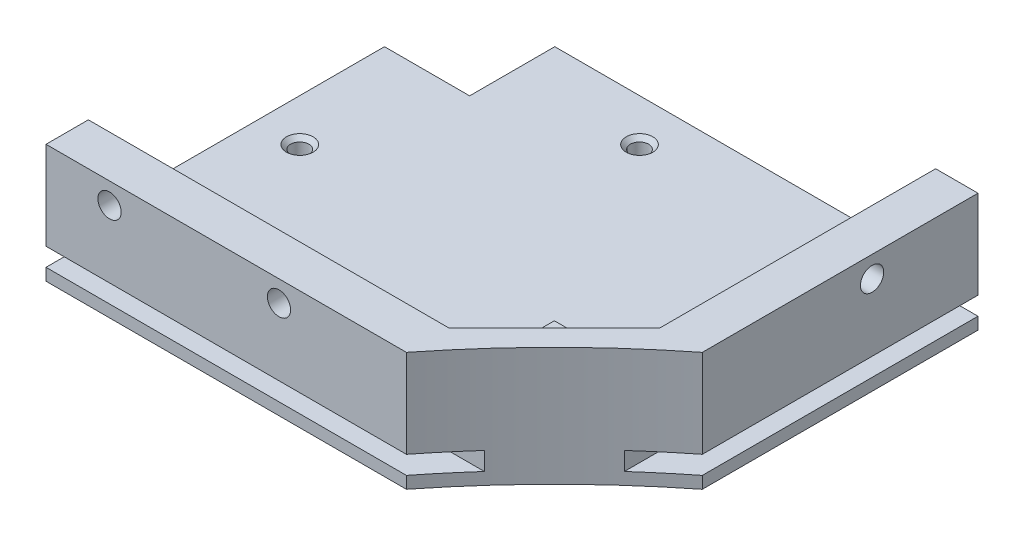
from build123d import *

# Parameters (mm, degrees)
SKETCH1_W                = 650
SKETCH1_H                = 650
BOSS_EXTRUDE1_DEPTH      = 8
BOSS_EXTRUDE2_DEPTH      = 650
CUT_EXTRUDE2_DEPTH       = 921.277302922
CUT_EXTRUDE2_DEPTH_BACK  = 921.277302922
SKETCH4_R                = 11
CUT_EXTRUDE1_DEPTH       = 920.932062709
CUT_EXTRUDE1_DEPTH_BACK  = 920.932062709
SKETCH2_R                = 210
CUT_EXTRUDE3_DEPTH       = 921.277302998
CUT_EXTRUDE3_DEPTH_BACK  = 110
CUT_EXTRUDE4_DEPTH       = 110
CUT_EXTRUDE5_DEPTH       = 920.932062713
CUT_EXTRUDE5_DEPTH_BACK  = 920.932062713
SKETCH7_OUTSIDE_W        = 836.056
SKETCH7_OUTSIDE_H        = 836.056
BOSS_EXTRUDE3_DEPTH      = 160.08
BOSS_EXTRUDE4_DEPTH      = 160.08
SKETCH21_W               = 10
SKETCH21_H               = 4.3
CUT_EXTRUDE10_DEPTH      = 680.197320372
SKETCH22_W               = 10
SKETCH22_H               = 4.3
CUT_EXTRUDE11_DEPTH      = 278.189465889
BOSS_EXTRUDE5_DEPTH      = 60
CUT_EXTRUDE6_DEPTH       = 679.914574891
CUT_EXTRUDE6_DEPTH_BACK  = 679.914574891
SKETCH12_R               = 210
CUT_EXTRUDE14_DEPTH      = 11
SKETCH27_R               = 2.75
CUT_EXTRUDE15_DEPTH      = 11
SKETCH28_R               = 2.75
CUT_EXTRUDE16_DEPTH      = 11
SKETCH29_W               = 20
SKETCH29_H               = 20
CUT_EXTRUDE17_DEPTH      = 10
CUT_EXTRUDE18_DEPTH      = 679.914574891
CUT_EXTRUDE18_DEPTH_BACK = 679.914574891
SKETCH30_W               = 195
SKETCH30_H               = 95
CUT_EXTRUDE19_DEPTH      = 589.600033979
CUT_EXTRUDE19_DEPTH_BACK = 589.600033979
SKETCH31_W               = 75
SKETCH31_H               = 100
SKETCH32_W               = 20.1
SKETCH32_H               = 20.1
CUT_EXTRUDE20_DEPTH      = 10
SKETCH33_R               = 2.15
CUT_EXTRUDE21_DEPTH      = 10
CHAMFER1_SIZE            = 1


with BuildPart() as part:
    # Sketch1 → Boss-Extrude1 (new body)
    with BuildSketch(Plane(origin=(0, 0, 0), x_dir=(1, 0, 0), z_dir=(0, 1, 0))):
        with Locations((325, 325)):
            Rectangle(SKETCH1_W, SKETCH1_H)
    extrude(amount=BOSS_EXTRUDE1_DEPTH)

    # Sketch3 → Boss-Extrude2 (add)
    with BuildSketch(Plane.XY):
        Polygon((300, 43.707142143), (350, 43.707142143), (385, 8), (265, 8), align=None)
    extrude(amount=-BOSS_EXTRUDE2_DEPTH)

    # Sketch4 → Cut-Extrude2 (cut, two sides: drawn at the far end of the back side and taken through both)
    with BuildSketch(Plane.XY.offset(-CUT_EXTRUDE2_DEPTH_BACK)):
        with Locations((325, 22)):
            Circle(SKETCH4_R)
    extrude(amount=CUT_EXTRUDE2_DEPTH + CUT_EXTRUDE2_DEPTH_BACK, mode=Mode.SUBTRACT)

    # Sketch2 → Cut-Extrude1 (cut, two sides: drawn at the far end of the back side and taken through both)
    with BuildSketch(Plane(origin=(0, 8, 0), x_dir=(1, 0, 0), z_dir=(0, 1, 0)).offset(-CUT_EXTRUDE1_DEPTH_BACK)):
        with Locations(Location((325, 325, 0), (0, 0, 270))):
            Circle(SKETCH2_R)
    extrude(amount=CUT_EXTRUDE1_DEPTH + CUT_EXTRUDE1_DEPTH_BACK, mode=Mode.SUBTRACT)

    # Sketch5 → Cut-Extrude3 (cut, two sides: drawn at the far end of the back side and taken through both)
    with BuildSketch(Plane.XY.offset(-CUT_EXTRUDE3_DEPTH_BACK)):
        Polygon((300, 43.707142143), (350, 43.707142143), (365.396078824, 28), (350, 28), (350, 8), (300, 8), (300, 28), (284.603921176, 28), align=None)
    extrude(amount=CUT_EXTRUDE3_DEPTH + CUT_EXTRUDE3_DEPTH_BACK, mode=Mode.SUBTRACT)

    # Sketch6 → Cut-Extrude4 (cut)
    with BuildSketch(Plane(origin=(0, 0, -650), x_dir=(-1, 0, 0), z_dir=(0, 0, -1))):
        Polygon((-350, 43.707142143), (-300, 43.707142143), (-284.603921176, 28), (-300, 28), (-300, 8), (-350, 8), (-350, 28), (-365.396078824, 28), align=None)
    extrude(amount=-CUT_EXTRUDE4_DEPTH, mode=Mode.SUBTRACT)

    # Sketch7 outside → Cut-Extrude5 (cut, two sides: drawn at the far end of the back side and taken through both)
    with BuildSketch(Plane(origin=(0, 8, 0), x_dir=(1, 0, 0), z_dir=(0, 1, 0)).offset(-CUT_EXTRUDE5_DEPTH_BACK)):
        with Locations((325, 325)):
            Rectangle(SKETCH7_OUTSIDE_W, SKETCH7_OUTSIDE_H)
        Polygon((195, 455), (195, 489.924225025), (195, 650), (167.478198198, 686.544504505), (-70.838918919, 686.544504505), (-70.838918919, 472.462112512), (0, 455), (160.075774975, 455), align=None, mode=Mode.SUBTRACT)
    extrude(amount=CUT_EXTRUDE5_DEPTH + CUT_EXTRUDE5_DEPTH_BACK, mode=Mode.SUBTRACT)

    # Sketch8 → Boss-Extrude3 (add)
    with BuildSketch(Plane(origin=(0, 0, -650), x_dir=(-1, 0, 0), z_dir=(0, 0, -1))):
        Polygon((-195, 8), (-195, 28), (-185, 28), (-185, 17), (-175, 8), align=None)
    extrude(amount=-BOSS_EXTRUDE3_DEPTH)

    # Sketch10 → Boss-Extrude4 (add)
    with BuildSketch(Plane.ZY):
        Polygon((-455, 8), (-455, 28), (-465, 28), (-465, 17), (-475, 8), align=None)
    extrude(amount=-BOSS_EXTRUDE4_DEPTH)

    # Sketch21 → Cut-Extrude10 (cut, through all)
    with BuildSketch(Plane.ZY):
        with Locations((-460, 5)):
            Rectangle(SKETCH21_W, SKETCH21_H)
    extrude(amount=-CUT_EXTRUDE10_DEPTH, mode=Mode.SUBTRACT)

    # Sketch22 → Cut-Extrude11 (cut, through all)
    with BuildSketch(Plane(origin=(0, 0, -650), x_dir=(-1, 0, 0), z_dir=(0, 0, -1))):
        with Locations((-190, 5)):
            Rectangle(SKETCH22_W, SKETCH22_H)
    extrude(amount=-CUT_EXTRUDE11_DEPTH, mode=Mode.SUBTRACT)

    # Sketch23 → Boss-Extrude5 (add)
    with BuildSketch(Plane.XY.offset(-489.92)):
        Polygon((194.99464011, 8), (195, 28), (160.08, 28), (160.08, 8), align=None)
    extrude(amount=BOSS_EXTRUDE5_DEPTH)

    # Sketch12 → Cut-Extrude6 (cut, two sides: drawn at the far end of the back side and taken through both)
    with BuildSketch(Plane(origin=(0, 8, 0), x_dir=(1, 0, 0), z_dir=(0, 1, 0)).offset(-CUT_EXTRUDE6_DEPTH_BACK)):
        with Locations((325, 325)):
            Circle(SKETCH12_R)
    extrude(amount=CUT_EXTRUDE6_DEPTH + CUT_EXTRUDE6_DEPTH_BACK, mode=Mode.SUBTRACT)

    # Sketch26 → Cut-Extrude14 (cut)
    with BuildSketch(Plane(origin=(0, 28, 0), x_dir=(1, 0, 0), z_dir=(0, 1, 0))):
        Polygon((185, 489.92), (160.08, 489.92), (160.08, 465), align=None)
    extrude(amount=-CUT_EXTRUDE14_DEPTH, mode=Mode.SUBTRACT)

    # Sketch27 → Cut-Extrude15 (cut)
    with BuildSketch(Plane.ZY.offset(-185)):
        with Locations((-610, 23)):
            Circle(SKETCH27_R)
        with Locations((-570, 23)):
            Circle(SKETCH27_R)
        with Locations((-530, 23)):
            Circle(SKETCH27_R)
    extrude(amount=-CUT_EXTRUDE15_DEPTH, mode=Mode.SUBTRACT)

    # Sketch28 → Cut-Extrude16 (cut)
    with BuildSketch(Plane(origin=(0, 0, -465), x_dir=(-1, 0, 0), z_dir=(0, 0, -1))):
        with Locations((-130, 23)):
            Circle(SKETCH28_R)
        with Locations((-90, 23)):
            Circle(SKETCH28_R)
        with Locations((-40, 23)):
            Circle(SKETCH28_R)
    extrude(amount=-CUT_EXTRUDE16_DEPTH, mode=Mode.SUBTRACT)

    # Sketch29 → Cut-Extrude17 (cut)
    with BuildSketch(Plane(origin=(0, 8, 0), x_dir=(1, 0, 0), z_dir=(0, 1, 0))):
        with Locations((10, 640)):
            Rectangle(SKETCH29_W, SKETCH29_H)
    extrude(amount=-CUT_EXTRUDE17_DEPTH, mode=Mode.SUBTRACT)

    # Sketch30 → Cut-Extrude18 (cut, two sides: drawn at the far end of the back side and taken through both)
    with BuildSketch(Plane(origin=(0, 8, 0), x_dir=(1, 0, 0), z_dir=(0, 1, 0)).offset(-CUT_EXTRUDE18_DEPTH_BACK)):
        with Locations((97.5, 602.5)):
            Rectangle(SKETCH30_W, SKETCH30_H)
    extrude(amount=CUT_EXTRUDE18_DEPTH + CUT_EXTRUDE18_DEPTH_BACK, mode=Mode.SUBTRACT)

    # Sketch31 → Cut-Extrude19 (cut, two sides: drawn at the far end of the back side and taken through both)
    with BuildSketch(Plane(origin=(0, 8, 0), x_dir=(1, 0, 0), z_dir=(0, 1, 0)).offset(-CUT_EXTRUDE19_DEPTH_BACK)):
        with Locations((37.5, 505)):
            Rectangle(SKETCH31_W, SKETCH31_H)
    extrude(amount=CUT_EXTRUDE19_DEPTH + CUT_EXTRUDE19_DEPTH_BACK, mode=Mode.SUBTRACT)

    # Sketch32 → Cut-Extrude20 (cut)
    with BuildSketch(Plane(origin=(0, 8, 0), x_dir=(1, 0, 0), z_dir=(0, 1, 0))):
        with Locations((85.05, 544.95)):
            Rectangle(SKETCH32_W, SKETCH32_H)
    extrude(amount=-CUT_EXTRUDE20_DEPTH, mode=Mode.SUBTRACT)

    # Sketch33 → Cut-Extrude21 (cut)
    with BuildSketch(Plane(origin=(0, 8, 0), x_dir=(1, 0, 0), z_dir=(0, 1, 0))):
        with Locations(Location((85, 504.9, 0), (0, 0, 270))):
            Circle(SKETCH33_R)
        with Locations(Location((125.1, 545, 0), (0, 0, 270))):
            Circle(SKETCH33_R)
    extrude(amount=-CUT_EXTRUDE21_DEPTH, mode=Mode.SUBTRACT)

    # Chamfer1
    chamfer1_edges = [part.edges().sort_by_distance(p)[0] for p in [
        (85, 8, -507.05),
        (125.1, 8, -547.15),
    ]]
    chamfer(chamfer1_edges, length=CHAMFER1_SIZE)


solid = part.part
